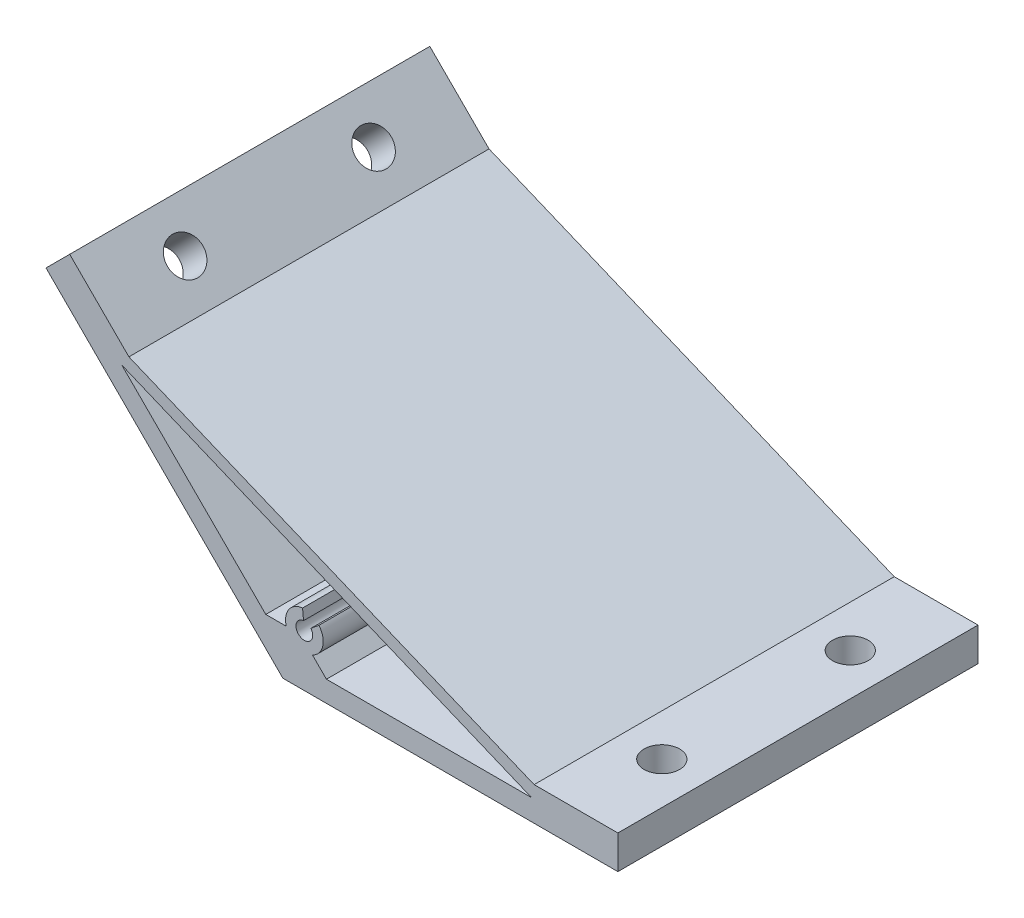
from build123d import *

# Parameters (mm, degrees)
EXTRUDE_1_DEPTH         = 43
HOLE_WIZARD_8_5_8_5_1_D = 8.5


with BuildPart() as part:
    # 草图1 → 凸台-拉伸1 (new, symmetric)
    with BuildSketch(Plane.XY):
        Polygon((6936.119122288, -1232.086390659), (6992.687664783, -1288.654933154), (7072.687664783, -1288.654933154), (7072.687664783, -1280.654933154), (7052.687664783, -1280.654933154), (6955.918112162, -1240.571672033), (6941.775976538, -1226.429536409), align=None)
        with BuildLine():
            Line((7009.090927681, -1283.654933154), (7003.090927681, -1283.654933154))
            Line((7003.090927681, -1283.654933154), (6999.760549745, -1280.324555218))
            ThreePointArc((6999.760549745, -1280.324555218), (7002.213755914, -1277.239517812), (7001.296666197, -1273.406161221))
            Line((7001.296666197, -1273.406161221), (6999.365595427, -1274.993916141))
            ThreePointArc((6999.365595427, -1274.993916141), (6997.055371947, -1278.111879141), (6997.626530039, -1274.273571671))
            Line((6997.626530039, -1274.273571671), (6997.383769074, -1271.785386165))
            ThreePointArc((6997.383769074, -1271.785386165), (6994.101203016, -1273.731324494), (6993.49338103, -1277.49861375))
            Line((6993.49338103, -1277.49861375), (6988.602413191, -1277.49861375))
            Line((6988.602413191, -1277.49861375), (6954.21874867, -1243.114949228))
            Line((6954.21874867, -1243.114949228), (7052.090927681, -1283.654933154))
            Line((7052.090927681, -1283.654933154), (7029.403393536, -1283.654933154))
            Line((7029.403393536, -1283.654933154), (7009.090927681, -1283.654933154))
        make_face(mode=Mode.SUBTRACT)
    extrude(amount=EXTRUDE_1_DEPTH, both=True)

    # Ø8.5 (8.5) 直径孔1 (through all)
    with Locations(Plane(origin=(2852.016365815, 2852.016365815, 0), x_dir=(0.7071067811865628, -0.7071067811865324, 0), z_dir=(-0.7071067811865324, -0.7071067811865628, 0))):
        with Locations((5785.79350833, -22.5), (5785.79350833, 22.5)):
            hole_wizard_8_5_8_5_1 = Hole(HOLE_WIZARD_8_5_8_5_1_D / 2)

    # 镜向1: Ø8.5 (8.5) 直径孔1 across plane
    add(hole_wizard_8_5_8_5_1.mirror(Plane(origin=(6424.240586557, -2661.0075789, 0), x_dir=(0, 0, 1), z_dir=(-0.9238795325112645, 0.3826834323651437, 0))), mode=Mode.SUBTRACT)


solid = part.part
